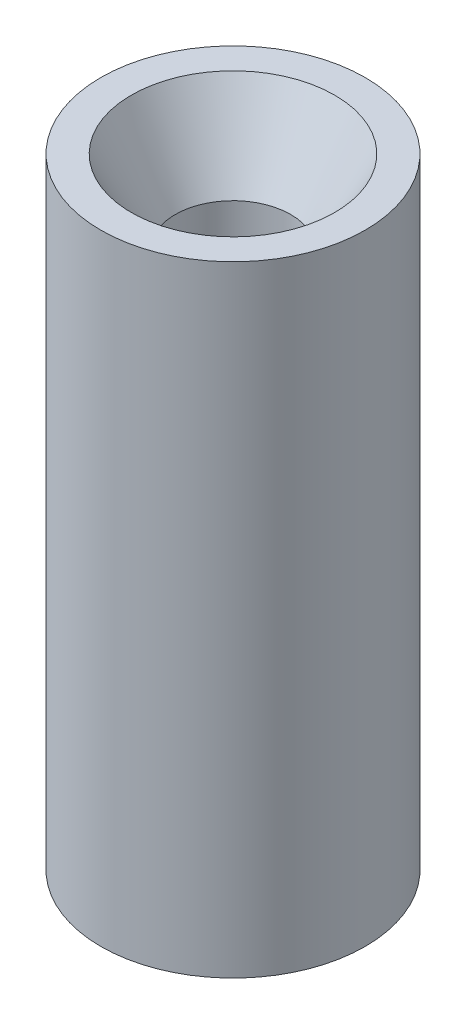
from build123d import *


with BuildPart() as part:
    # Croquis2 → Revolución1 (revolve)
    with BuildSketch(Plane.XY, mode=Mode.PRIVATE) as revoluci_n1_sk:
        Polygon((-10, 0), (-5.675, 8), (-5.675, 53), (-10, 61), (-13, 61), (-13, 0), align=None)
    revolve(revoluci_n1_sk.sketch.rotate(Axis((0, -23.584933646, 0), (0, 1, 0)), 270), axis=Axis((0, -23.584933646, 0), (0, 1, 0)))


solid = part.part
